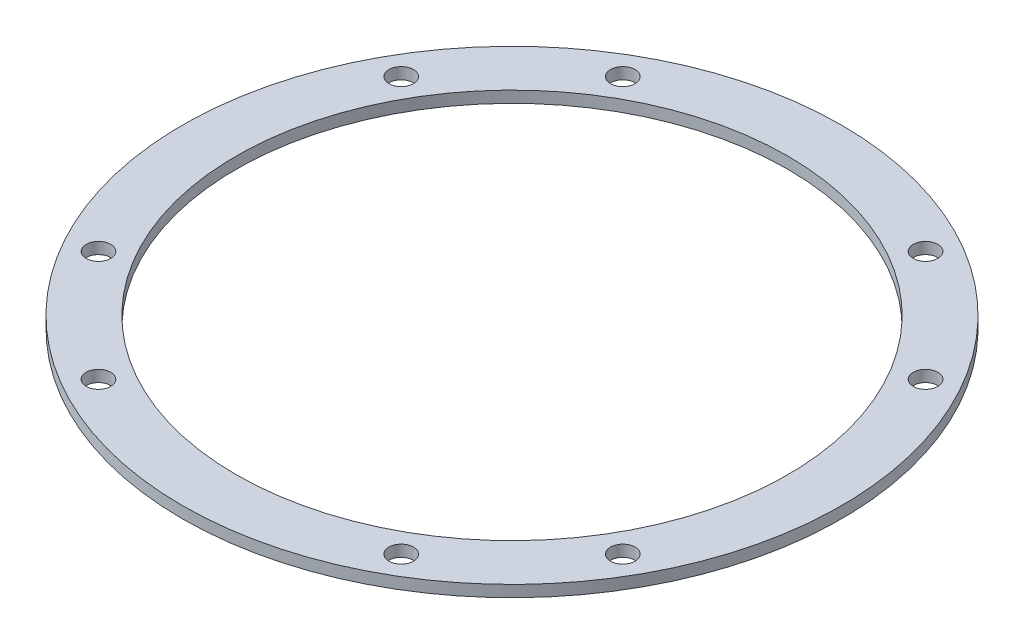
from build123d import *

# Parameters (mm, degrees)
SKETCH1_R                  = 43
SKETCH1_R_2                = 36
BOSS_EXTRUDE1_DEPTH        = 0.75
F_3_2_3_2_DIAMETER_HOLE1_D = 3.2


with BuildPart() as part:
    # Sketch1 → Boss-Extrude1 (new, symmetric)
    with BuildSketch(Plane(origin=(0, 0, 0), x_dir=(1, 0, 0), z_dir=(0, 1, 0))):
        with Locations(Location((0, 0, 0), (0, 0, 270))):
            Circle(SKETCH1_R)
        with Locations(Location((0, 0, 0), (0, 0, 270))):
            Circle(SKETCH1_R_2, mode=Mode.SUBTRACT)
    extrude(amount=BOSS_EXTRUDE1_DEPTH, both=True)

    # Ø3.2 (3.2) Diameter Hole1 (through all)
    with Locations(Plane(origin=(0, 0.75, 0), x_dir=(1, 0, 0), z_dir=(0, 1, 0))):
        with Locations((-34.208003449, -19.75), (-34.208003449, 19.75), (-19.75, 34.208003449), (19.75, 34.208003449), (34.208003449, 19.75), (34.208003449, -19.75), (19.75, -34.208003449), (-19.75, -34.208003449), (0, 0)):
            Hole(F_3_2_3_2_DIAMETER_HOLE1_D / 2)


solid = part.part
